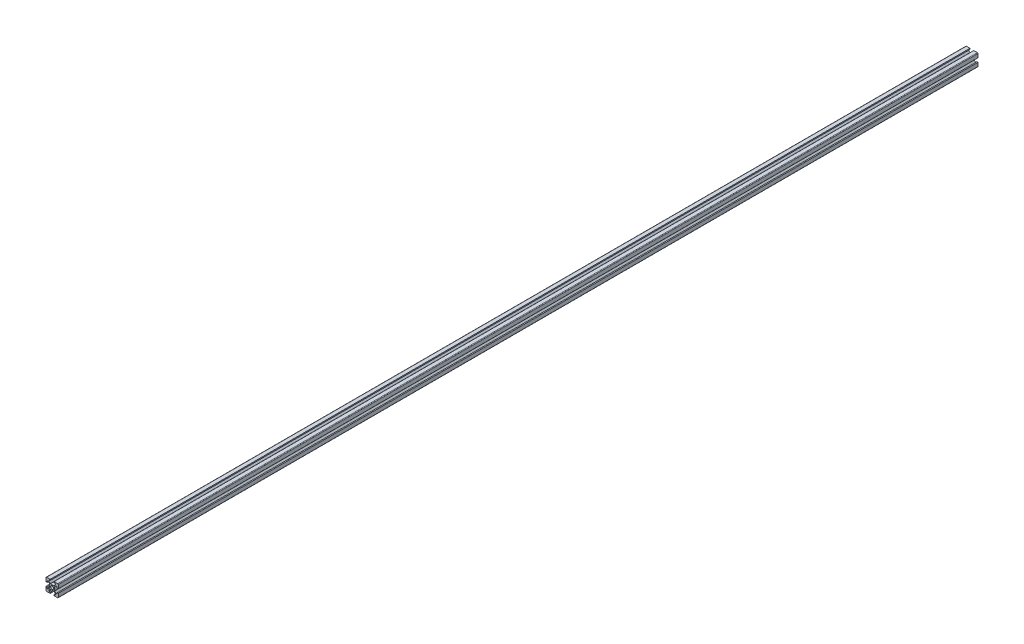
from build123d import *

# Parameters (mm, degrees)
SKETCH1_R           = 2.5
BOSS_EXTRUDE1_DEPTH = 1500
FILLET1_R           = 1
FILLET2_R           = 0.5
FILLET3_R           = 0.5
FILLET4_R           = 0.5
FILLET5_R           = 0.5


with BuildPart() as part:
    # Sketch1 → Boss-Extrude1 (new body)
    with BuildSketch(Plane.XY):
        Polygon((13.2, 0), (13.2, 1.8), (15.45, 1.8), (15.45, 3.6), (12.95, 6.1), (7.05, 6.1), (4.55, 3.6), (4.55, 1.8), (6.8, 1.8), (6.8, 0), (0, 0), (0, 6.8), (1.8, 6.8), (1.8, 4.55), (3.6, 4.55), (6.1, 7.05), (6.1, 12.95), (3.6, 15.45), (1.8, 15.45), (1.8, 13.2), (0, 13.2), (0, 20), (6.8, 20), (6.8, 18.2), (4.55, 18.2), (4.55, 16.4), (7.05, 13.9), (12.95, 13.9), (15.45, 16.4), (15.45, 18.2), (13.2, 18.2), (13.2, 20), (20, 20), (20, 13.2), (18.2, 13.2), (18.2, 15.45), (16.4, 15.45), (13.9, 12.95), (13.9, 7.05), (16.4, 4.55), (18.2, 4.55), (18.2, 6.8), (20, 6.8), (20, 0), align=None)
        with Locations((10, 10)):
            Circle(SKETCH1_R, mode=Mode.SUBTRACT)
    extrude(amount=BOSS_EXTRUDE1_DEPTH)

    # Fillet1
    fillet1_edges = [part.edges().sort_by_distance(p)[0] for p in [
        (0, 0, 750),
        (0, 20, 750),
        (20, 20, 750),
        (20, 0, 750),
    ]]
    fillet(fillet1_edges, radius=FILLET1_R)

    # Fillet2
    fillet2_edges = [part.edges().sort_by_distance(p)[0] for p in [
        (4.55, 18.2, 750),
        (4.55, 16.4, 750),
        (7.05, 13.9, 750),
        (12.95, 13.9, 750),
        (15.45, 16.4, 750),
        (15.45, 18.2, 750),
    ]]
    fillet(fillet2_edges, radius=FILLET2_R)

    # Fillet3
    fillet3_edges = [part.edges().sort_by_distance(p)[0] for p in [
        (18.2, 15.45, 750),
        (16.4, 15.45, 750),
        (13.9, 12.95, 750),
        (13.9, 7.05, 750),
        (16.4, 4.55, 750),
        (18.2, 4.55, 750),
    ]]
    fillet(fillet3_edges, radius=FILLET3_R)

    # Fillet4
    fillet4_edges = [part.edges().sort_by_distance(p)[0] for p in [
        (1.8, 4.55, 750),
        (3.6, 4.55, 750),
        (6.1, 7.05, 750),
        (6.1, 12.95, 750),
        (3.6, 15.45, 750),
        (1.8, 15.45, 750),
    ]]
    fillet(fillet4_edges, radius=FILLET4_R)

    # Fillet5
    fillet5_edges = [part.edges().sort_by_distance(p)[0] for p in [
        (15.45, 1.8, 750),
        (15.45, 3.6, 750),
        (12.95, 6.1, 750),
        (7.05, 6.1, 750),
        (4.55, 3.6, 750),
        (4.55, 1.8, 750),
    ]]
    fillet(fillet5_edges, radius=FILLET5_R)


solid = part.part
